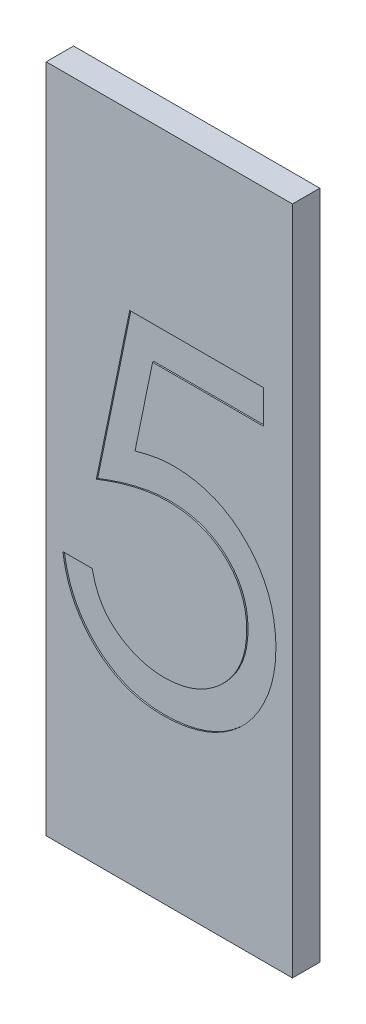
from build123d import *

# Parameters (mm, degrees)
SKETCH_1_W          = 18
SKETCH_1_H          = 49
EXTRUDE_1_DEPTH     = 2
CUT_EXTRUDE_1_DEPTH = 0.1


with BuildPart() as part:
    # ｽｹｯﾁ1 → ﾎﾞｽ - 押し出し1 (new body)
    with BuildSketch(Plane.XY):
        with Locations((9, 24.5)):
            Rectangle(SKETCH_1_W, SKETCH_1_H)
    extrude(amount=EXTRUDE_1_DEPTH)

    # ｽｹｯﾁ2 → ｶｯﾄ - 押し出し1 (cut)
    with BuildSketch(Plane.XY.offset(2)):
        with BuildLine():
            Line((15.875, 36.3125), (15.875, 33.870192308))
            Line((15.875, 33.870192308), (7.775315505, 33.870192308))
            Line((7.775315505, 33.870192308), (6.49214994, 27.607008714))
            add(Edge.make_bspline(
                [(6.49214994, 27.607008714), (6.744262228, 27.676611099), (7.232689912, 27.811454712), (7.953595395, 27.961172542), (8.637981636, 28.051424939), (9.082087281, 28.063748319), (9.29698768, 28.069711538)],
                knots=[0, 0, 0, 0, 1.100273476, 2.13160584, 3.095893838, 4, 4, 4, 4], degree=3))
            add(Edge.make_bspline(
                [(9.29698768, 28.069711538), (9.562896695, 28.063956155), (10.085740255, 28.052639632), (10.850726663, 27.943974013), (11.580973668, 27.772932808), (12.27495408, 27.53398783), (12.933951755, 27.228441252), (13.551903557, 26.846761301), (14.138085072, 26.400900602), (14.68198022, 25.888285431), (15.175404531, 25.324122288), (15.609240996, 24.717530344), (15.977740048, 24.074404643), (16.274108756, 23.388600502), (16.510766458, 22.667699833), (16.668282709, 21.904117441), (16.77317139, 21.105050767), (16.784889768, 20.558692889), (16.790865385, 20.280085637)],
                knots=[0, 0, 0, 0, 1.052922333, 2.070308379, 3.05430497, 4.020497103, 4.973039431, 5.925935799, 6.892292201, 7.88610001, 8.88166317, 9.857072816, 10.836096531, 11.812156883, 12.81219415, 13.836441305, 14.89672472, 16, 16, 16, 16], degree=3))
            add(Edge.make_bspline(
                [(16.790865385, 20.280085637), (16.786340497, 20.086032674), (16.777351873, 19.700549205), (16.731641482, 19.128068125), (16.643632414, 18.567706707), (16.525469862, 18.019390612), (16.372100912, 17.48415792), (16.186437884, 16.960476631), (15.959225626, 16.451606182), (15.710001448, 15.952731619), (15.429378088, 15.475131061), (15.117920743, 15.028483492), (14.788862669, 14.606088649), (14.434795386, 14.212476644), (14.052427901, 13.850233968), (13.646390984, 13.517210839), (13.219924628, 13.20777536), (12.766430926, 12.934488174), (12.296015104, 12.683008062), (11.801883841, 12.47669971), (11.295285147, 12.292251296), (10.76892769, 12.145229331), (10.224003714, 12.030027487), (9.659614974, 11.951782329), (9.078721487, 11.894792638), (8.684964705, 11.891225138), (8.486065204, 11.889423077)],
                knots=[0, 0, 0, 0, 1.056347294, 2.098418968, 3.122841568, 4.141288669, 5.149314143, 6.15115421, 7.162517403, 8.180376062, 9.185164535, 10.17417709, 11.141909838, 12.097768115, 13.052685741, 14.0056014, 14.954263652, 15.917497458, 16.885230207, 17.854509472, 18.828990115, 19.81800267, 20.826176721, 21.857883937, 22.917946725, 24, 24, 24, 24], degree=3))
            add(Edge.make_bspline(
                [(8.486065204, 11.889423077), (8.248796225, 11.894123242), (7.781997537, 11.903370263), (7.098098679, 12.000106743), (6.440093951, 12.138654103), (5.813280227, 12.347090153), (5.212040023, 12.608260854), (4.644467603, 12.938344093), (4.096060448, 13.312398352), (3.589112484, 13.753816468), (3.118603926, 14.236296376), (2.697418571, 14.759883184), (2.322313344, 15.315935282), (1.999295101, 15.90715308), (1.72376392, 16.531983085), (1.507308375, 17.192766359), (1.332603853, 17.886050314), (1.258693796, 18.363344733), (1.221153846, 18.605769231)],
                knots=[0, 0, 0, 0, 1.0467383, 2.05933395, 3.04377827, 4.011590433, 4.970194871, 5.932262533, 6.905835911, 7.896367577, 8.894135286, 9.877477877, 10.858688626, 11.851381753, 12.8477658, 13.868841284, 14.917554742, 16, 16, 16, 16], degree=3))
            Line((1.221153846, 18.605769231), (3.358173077, 18.605769231))
            add(Edge.make_bspline(
                [(3.358173077, 18.605769231), (3.410754869, 18.378690153), (3.511819994, 17.942231555), (3.733655534, 17.329016537), (4.004885865, 16.782558961), (4.327404736, 16.295630189), (4.712146908, 15.871026119), (5.151177487, 15.492631465), (5.643400389, 15.151261389), (6.190361469, 14.866717205), (6.767393312, 14.624042293), (7.371327366, 14.46244594), (7.985719437, 14.348820223), (8.401270492, 14.337446279), (8.610088642, 14.331730769)],
                knots=[0, 0, 0, 0, 1.136247022, 2.183929868, 3.172523383, 4.106158343, 5.02341133, 5.958108904, 6.928429099, 7.938127109, 8.96079061, 9.975095812, 10.982467395, 12, 12, 12, 12], degree=3))
            add(Edge.make_bspline(
                [(8.610088642, 14.331730769), (8.813913058, 14.33731499), (9.215245002, 14.348310367), (9.805872472, 14.432940075), (10.376099349, 14.563279979), (10.920299044, 14.758337386), (11.447994518, 14.995405916), (11.945837492, 15.299628129), (12.428230281, 15.64974004), (12.880178833, 16.050855684), (13.294104371, 16.492881642), (13.659837981, 16.96557605), (13.96448091, 17.46983531), (14.221207615, 17.996929439), (14.41615238, 18.552635337), (14.555224056, 19.13434869), (14.636887724, 19.743506323), (14.648121645, 20.158995734), (14.653846154, 20.370718149)],
                knots=[0, 0, 0, 0, 1.027316725, 2.022795036, 3.002884548, 3.971462791, 4.93288096, 5.914575861, 6.907176829, 7.935150275, 8.956128384, 9.956726525, 10.942570165, 11.921478529, 12.907843606, 13.90538589, 14.932640048, 16, 16, 16, 16], degree=3))
            add(Edge.make_bspline(
                [(14.653846154, 20.370718149), (14.649366142, 20.561733531), (14.640597156, 20.935618961), (14.568951668, 21.482620705), (14.444330839, 22.000189082), (14.271357655, 22.490823424), (14.051741719, 22.954986487), (13.783365915, 23.393157308), (13.46119369, 23.799560709), (13.093175662, 24.174386832), (12.690009348, 24.52031357), (12.244758171, 24.815208159), (11.76673974, 25.063293027), (11.261713358, 25.277387801), (10.717666459, 25.431153587), (10.145372942, 25.546595808), (9.53865284, 25.613375329), (9.123834408, 25.622641033), (8.910606971, 25.627403846)],
                knots=[0, 0, 0, 0, 1.045622112, 2.046656509, 3.013763289, 3.955457236, 4.890082067, 5.820317437, 6.762574623, 7.722996705, 8.69280354, 9.665887285, 10.63943826, 11.638615906, 12.663482002, 13.728887084, 14.832589034, 16, 16, 16, 16], degree=3))
            add(Edge.make_bspline(
                [(8.910606971, 25.627403846), (8.726033366, 25.623453753), (8.344935699, 25.615297812), (7.76035361, 25.55524611), (7.146047423, 25.458368054), (6.504372016, 25.32511162), (5.833400345, 25.150728758), (5.134548368, 24.94176046), (4.406346697, 24.691919718), (3.915688608, 24.503241621), (3.663461538, 24.40625)],
                knots=[0, 0, 0, 0, 0.817624296, 1.688186739, 2.600797293, 3.572016777, 4.590301741, 5.671205678, 6.80286297, 8, 8, 8, 8], degree=3))
            Line((3.663461538, 24.40625), (6.105769231, 36.3125))
            Line((6.105769231, 36.3125), (15.875, 36.3125))
        make_face()
    extrude(amount=-CUT_EXTRUDE_1_DEPTH, mode=Mode.SUBTRACT)


solid = part.part
